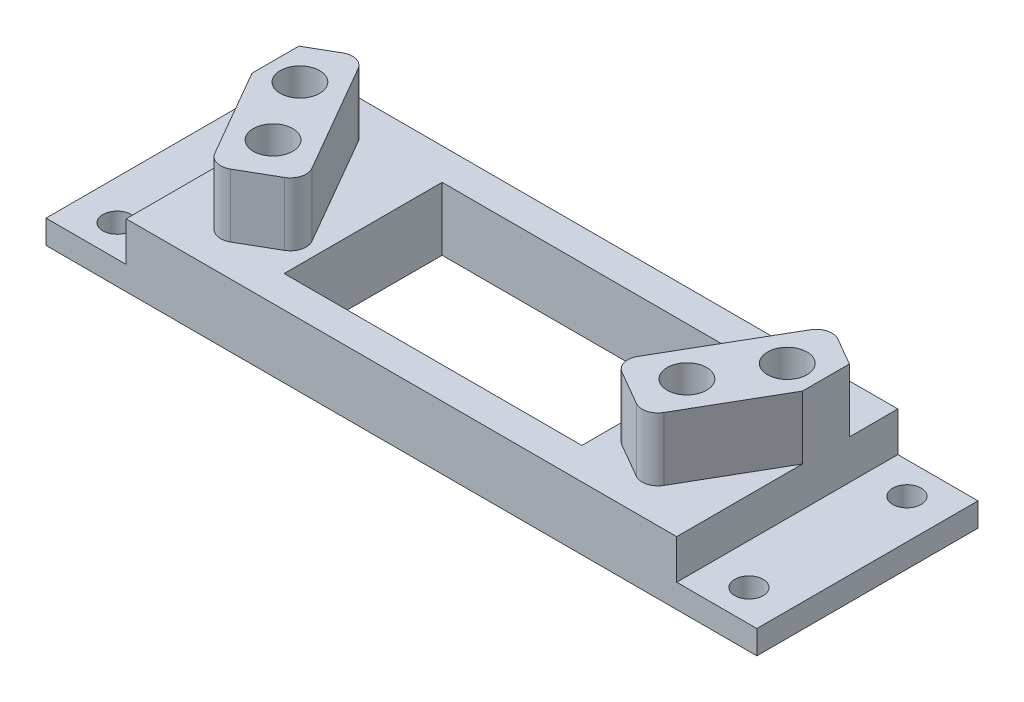
from build123d import *

# Parameters (mm, degrees)
SKETCH1_W                = 10.15
SKETCH1_H                = 28
SKETCH1_W_2              = 69.7
BOSS_EXTRUDE1_DEPTH      = 3
SKETCH1_3_W              = 69.7
SKETCH1_3_H              = 28
BOSS_EXTRUDE2_DEPTH      = 8
SKETCH2_R                = 2.5
CUT_EXTRUDE1_DEPTH       = 6
BOSS_EXTRUDE3_START      = -8
SKETCH3_R                = 2.5
BOSS_EXTRUDE3_DEPTH      = 8
FILLET1_R                = 2
FILLET1_OF_MIRROR1_R     = 2
M3_CLEARANCE_HOLE1_D     = 3.6
M3_CLEARANCE_HOLE1_DEPTH = 10
M3_CLEARANCE_HOLE1_TIP   = 1.081549114
SKETCH6_W                = 37.7
SKETCH6_H                = 20
CUT_EXTRUDE2_DEPTH       = 48.801673611


with BuildPart() as part:
    # Sketch1 → Boss-Extrude1 (new body)
    with BuildSketch(Plane(origin=(0, 0, 0), x_dir=(1, 0, 0), z_dir=(0, 1, 0))):
        with Locations((-39.925, 0)):
            Rectangle(SKETCH1_W, SKETCH1_H)
        Rectangle(SKETCH1_W_2, SKETCH1_H)
        with Locations((39.925, 0)):
            Rectangle(SKETCH1_W, SKETCH1_H)
    extrude(amount=BOSS_EXTRUDE1_DEPTH)

    # Sketch1<3> → Boss-Extrude2 (add)
    with BuildSketch(Plane(origin=(0, 0, 0), x_dir=(1, 0, 0), z_dir=(0, 1, 0))):
        Rectangle(SKETCH1_3_W, SKETCH1_3_H)
    extrude(amount=BOSS_EXTRUDE2_DEPTH)

    # Sketch2 → Cut-Extrude1 (cut)
    with BuildSketch(Plane.XZ.offset(-8)):
        with Locations(Location((-30.85, -4, 0), (0, 0, 90))):
            Circle(SKETCH2_R)
        with Locations(Location((-26.2, 4.054036255, 0), (0, 0, 90))):
            Circle(SKETCH2_R)
    cut_extrude1 = extrude(amount=CUT_EXTRUDE1_DEPTH, mode=Mode.SUBTRACT)

    # Sketch3 → Boss-Extrude3 (add)
    with BuildSketch(Plane.XZ.offset(-8).offset(BOSS_EXTRUDE3_START)):
        Polygon((-29.627885683, -10.88323591), (-19.627885683, 6.437272165), (-27.422114317, 10.937272165), (-34.85, -1.92820323), (-34.85, -7.868246804), align=None)
        with Locations(Location((-30.85, -4, 0), (0, 0, 90))):
            Circle(SKETCH3_R, mode=Mode.SUBTRACT)
        with Locations(Location((-26.2, 4.054036255, 0), (0, 0, 90))):
            Circle(SKETCH3_R, mode=Mode.SUBTRACT)
    boss_extrude3 = extrude(amount=BOSS_EXTRUDE3_DEPTH)

    # Fillet1
    fillet1_edges = [part.edges().sort_by_distance(p)[0] for p in [
        (-27.422114317, 12, 10.937272165),
        (-19.627885683, 12, 6.437272165),
        (-29.627885683, 12, -10.88323591),
    ]]
    fillet(fillet1_edges, radius=FILLET1_R)

    # Mirror1: Cut-Extrude1, Boss-Extrude3 across plane
    add(cut_extrude1.mirror(Plane(origin=(0, 0, 0), x_dir=(0, 0, 1), z_dir=(1, 0, 0))), mode=Mode.SUBTRACT)
    add(boss_extrude3.mirror(Plane(origin=(0, 0, 0), x_dir=(0, 0, 1), z_dir=(1, 0, 0))))

    # Fillet1 of Mirror1
    fillet1_of_mirror1_edges = [part.edges().sort_by_distance(p)[0] for p in [
        (27.422114317, 12, 10.937272165),
        (19.627885683, 12, 6.437272165),
        (29.627885683, 12, -10.88323591),
    ]]
    fillet(fillet1_of_mirror1_edges, radius=FILLET1_OF_MIRROR1_R)

    # M3 Clearance Hole1
    with Locations(Plane(origin=(0, 3, 0), x_dir=(1, 0, 0), z_dir=(0, 1, 0))):
        with Locations((-40, 10), (-40, -10), (40, -10), (40, 10)):
            Hole(M3_CLEARANCE_HOLE1_D / 2, depth=M3_CLEARANCE_HOLE1_DEPTH)
            with Locations((0, 0, -(M3_CLEARANCE_HOLE1_DEPTH + M3_CLEARANCE_HOLE1_TIP / 2))):  # 118° drill point
                Cone(0, M3_CLEARANCE_HOLE1_D / 2, M3_CLEARANCE_HOLE1_TIP, mode=Mode.SUBTRACT)

    # Sketch6 → Cut-Extrude2 (cut, through all)
    with BuildSketch(Plane(origin=(0, 8, 0), x_dir=(1, 0, 0), z_dir=(0, 1, 0))):
        Rectangle(SKETCH6_W, SKETCH6_H)
    extrude(amount=-CUT_EXTRUDE2_DEPTH, mode=Mode.SUBTRACT)


solid = part.part
